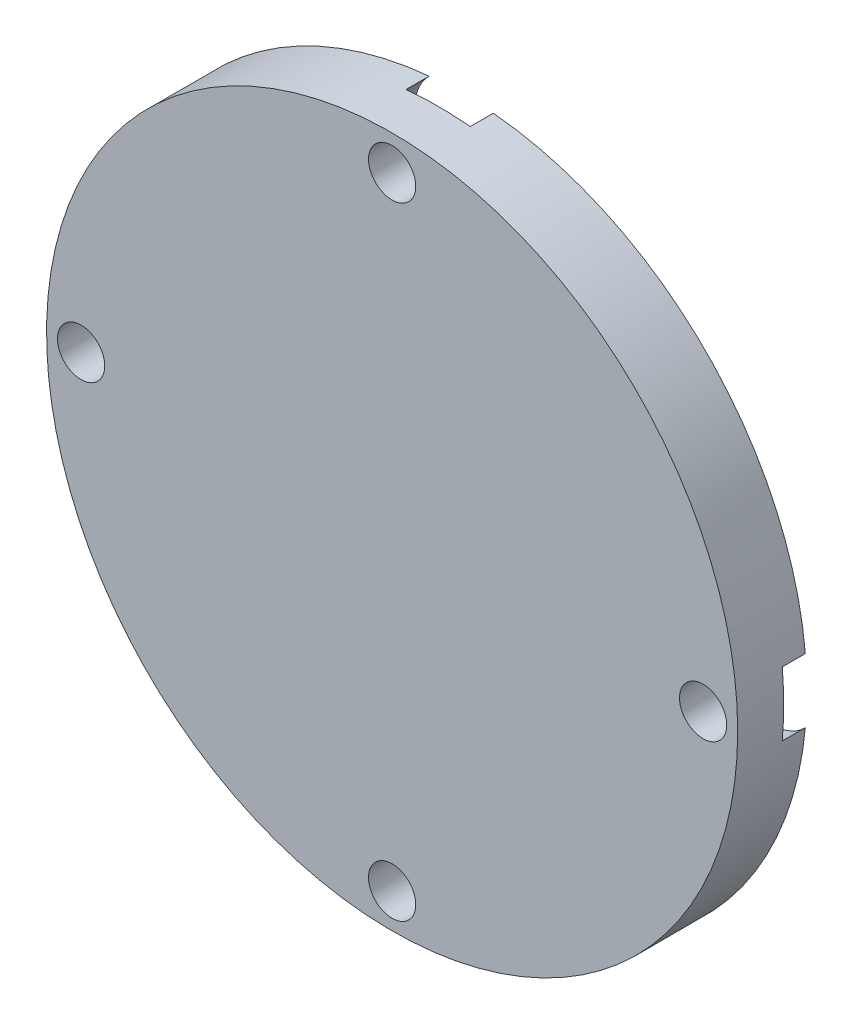
from build123d import *

# Parameters (mm, degrees)
SKETCH_1_R          = 15
EXTRUDE_1_DEPTH     = 3
SKETCH_2_R          = 1.025
CUT_EXTRUDE_2_DEPTH = 22.424285286
SKETCH_3_R          = 2
CUT_EXTRUDE_3_DEPTH = 1


with BuildPart() as part:
    # 草图1 → 凸台-拉伸1 (new body)
    with BuildSketch(Plane.XY):
        Circle(SKETCH_1_R)
    extrude(amount=EXTRUDE_1_DEPTH)

    # 草图2 → 切除-拉伸2 (cut, through all)
    with BuildSketch(Plane.XY):
        with Locations((0, 13.5)):
            Circle(SKETCH_2_R)
        with Locations((13.5, 0)):
            Circle(SKETCH_2_R)
        with Locations((0, -13.5)):
            Circle(SKETCH_2_R)
        with Locations((-13.5, 0)):
            Circle(SKETCH_2_R)
    extrude(amount=CUT_EXTRUDE_2_DEPTH, mode=Mode.SUBTRACT)

    # 草图3 → 切除-拉伸3 (cut)
    with BuildSketch(Plane(origin=(0, 0, 0), x_dir=(-1, 0, 0), z_dir=(0, 0, -1))):
        with Locations((0, 13.5)):
            Circle(SKETCH_3_R)
        with Locations((13.5, 0)):
            Circle(SKETCH_3_R)
        with Locations((-13.5, 0)):
            Circle(SKETCH_3_R)
        with Locations((0, -13.5)):
            Circle(SKETCH_3_R)
    extrude(amount=-CUT_EXTRUDE_3_DEPTH, mode=Mode.SUBTRACT)


solid = part.part
